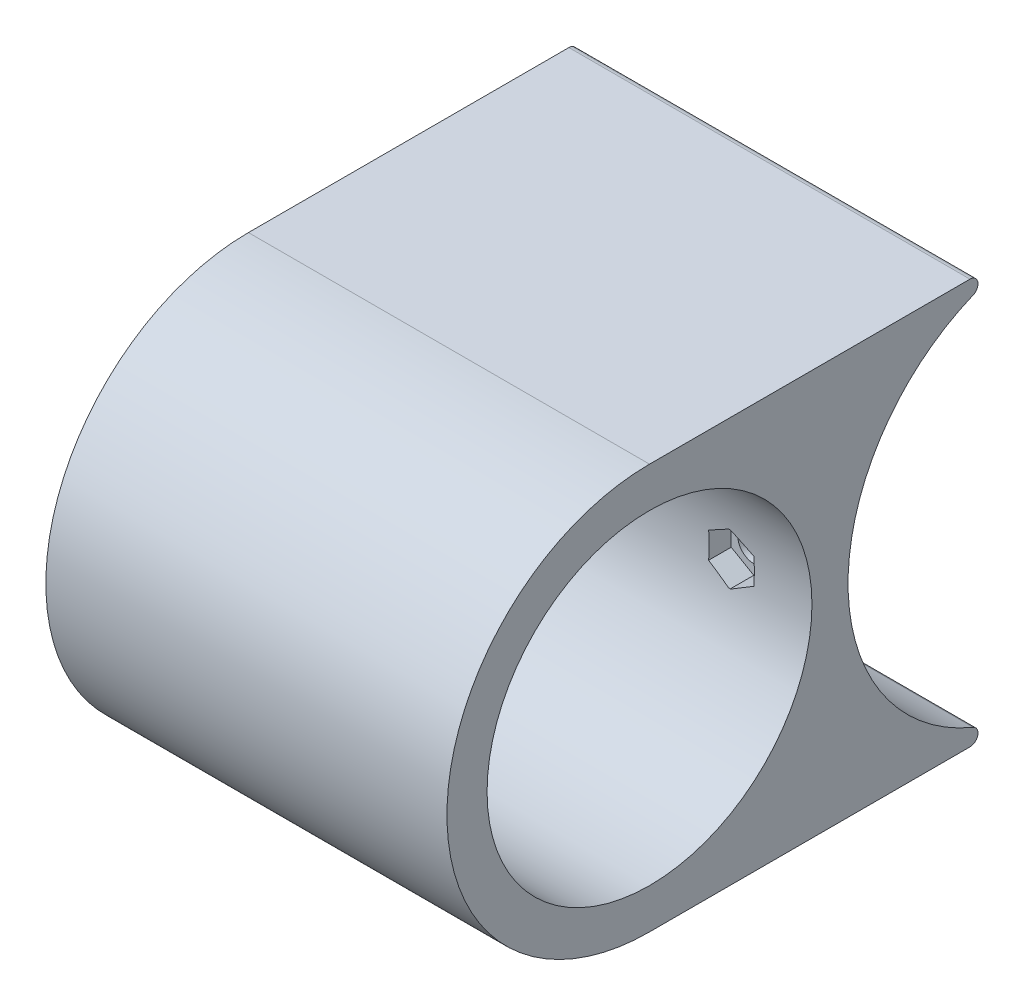
from build123d import *

# Parameters (mm, degrees)
EXTRUDE_1_DEPTH      = 25
EXTRUDE_1_DEPTH_BACK = 25
SKETCH_1_R           = 20.25
SKETCH_2_R           = 2
CUT_EXTRUDE_1_DEPTH  = 41
CUT_EXTRUDE_2_DEPTH  = 3


with BuildPart() as part:
    # 草图1 → 凸台-拉伸1 (new, two sides: drawn at the far end of the back side and taken through both)
    with BuildSketch(Plane(origin=(0, 0, 0), x_dir=(0, 0, -1), z_dir=(1, 0, 0)).offset(-EXTRUDE_1_DEPTH_BACK)):
        with BuildLine():
            Line((39.950124379, 25.25), (0, 25.25))
            ThreePointArc((0, 25.25), (-25.25, 0), (0, -25.25))
            Line((0, -25.25), (39.950124379, -25.25))
            ThreePointArc((39.950124379, -25.25), (40.930891814, -24.445180015), (40.332976783, -23.326190476))
            ThreePointArc((40.332976783, -23.326190476), (24.75, 0), (40.332976783, 23.326190476))
            ThreePointArc((40.332976783, 23.326190476), (40.930891814, 24.445180015), (39.950124379, 25.25))
        make_face()
        Circle(SKETCH_1_R, mode=Mode.SUBTRACT)
    extrude(amount=EXTRUDE_1_DEPTH + EXTRUDE_1_DEPTH_BACK)

    # 草图2 → 切除-拉伸1 (cut)
    with BuildSketch(Plane.XY):
        with Locations((-15, 0)):
            Circle(SKETCH_2_R)
        with Locations((15, 0)):
            Circle(SKETCH_2_R)
    extrude(amount=-CUT_EXTRUDE_1_DEPTH, mode=Mode.SUBTRACT)

    # 草图3 → 切除-拉伸2 (cut)
    with BuildSketch(Plane.XY.offset(-20)):
        Polygon((-15, 3.25), (-17.814582562, 1.625), (-17.814582562, -1.625), (-15, -3.25), (-12.185417438, -1.625), (-12.185417438, 1.625), align=None)
        Polygon((15, 3.25), (12.185417438, 1.625), (12.185417438, -1.625), (15, -3.25), (17.814582562, -1.625), (17.814582562, 1.625), align=None)
    extrude(amount=-CUT_EXTRUDE_2_DEPTH, mode=Mode.SUBTRACT)


solid = part.part
